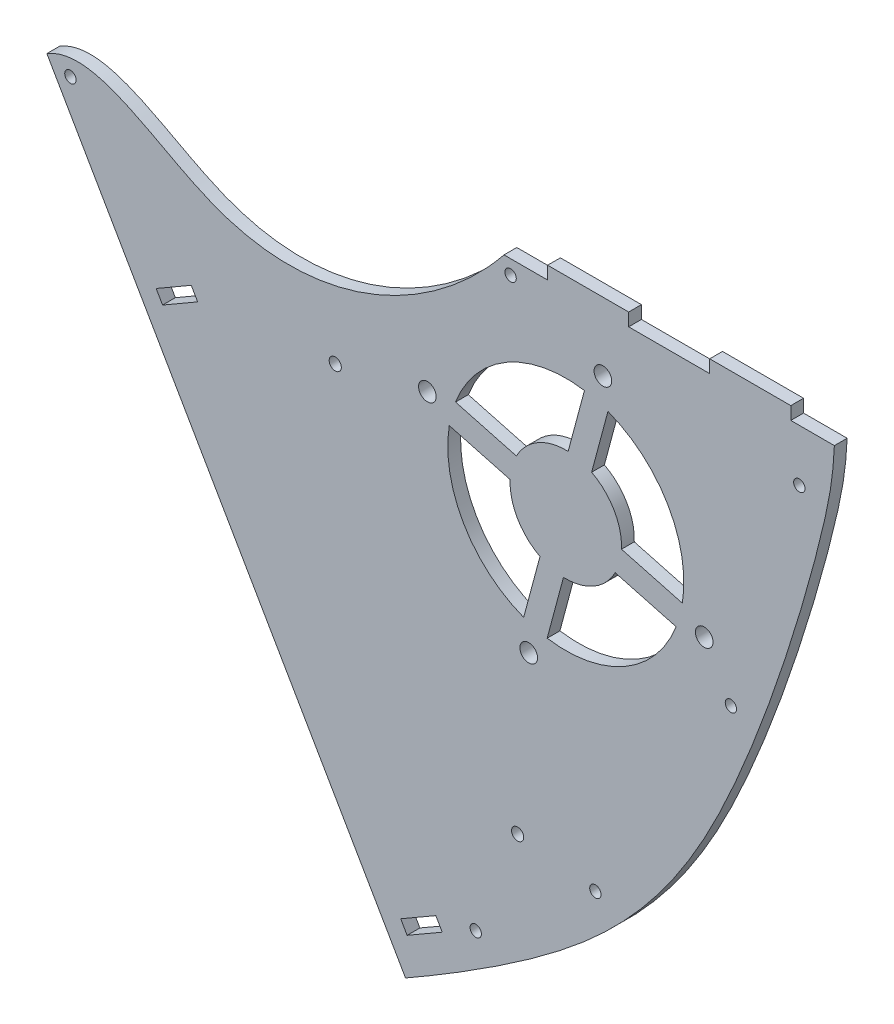
from build123d import *

# Parameters (mm, degrees)
SKETCH1_W           = 20
SKETCH1_H           = 3.17
BOSS_EXTRUDE1_DEPTH = 3.15
SKETCH3_R           = 1.5
CUT_EXTRUDE3_DEPTH  = 4
SKETCH4_R           = 1.4
CUT_EXTRUDE4_DEPTH  = 300.367282694
SKETCH5_R           = 1.4
CUT_EXTRUDE5_DEPTH  = 10
SKETCH8_R           = 1.4
CUT_EXTRUDE6_DEPTH  = 3.15
SKETCH10_R          = 2.175
CUT_EXTRUDE9_DEPTH  = 10


with BuildPart() as part:
    # Sketch1 → Boss-Extrude1 (new body)
    # profile 1 of 3: a face of its own
    with BuildSketch(Plane.XY):
        with BuildLine():
            Line((-241.698190941, -23.342278563), (-182.984296622, -125.037726634))
            Line((-182.984296622, -125.037726634), (-153.206187055, -176.614925358))
            add(Edge.make_bspline(
                [(-47.401899165, -9.957262145), (-47.829142386, -14.25185708), (-46.723988324, -19.969891501), (-68.682398123, -93.959649611), (-98.488851457, -144.156557444), (-142.971221813, -170.754120269), (-153.206187055, -176.614925358)],
                knots=[0.137311336, 0.137311336, 0.137311336, 0.137311336, 0.404180931, 0.63636099, 0.837197323, 0.978117302, 0.978117302, 0.978117302, 0.978117302], degree=3))
            Line((-47.401899165, -9.957262145), (-128.909491715, -9.957262145))
            add(Edge.make_bspline(
                [(-241.698190941, -23.342278563), (-229.917917727, -16.192032852), (-187.817846519, -53.973476211), (-145.539794723, -30.618927667), (-128.909491715, -9.957262145)],
                knots=[0, 0, 0, 0, 0.348890398, 1, 1, 1, 1], degree=3))
        make_face()
        Polygon((-206.071121951, -55.050172178), (-214.731375989, -60.050172178), (-213.146375989, -62.795472708), (-204.486121951, -57.795472708), align=None, mode=Mode.SUBTRACT)
        Polygon((-145.736121951, -159.553457653), (-154.396375989, -164.553457653), (-152.811375989, -167.298758183), (-144.151121951, -162.298758183), align=None, mode=Mode.SUBTRACT)
    # profile 2 of 3: a face of its own
    with BuildSketch(Plane.XY):
        with Locations((-108.15569544, -8.372262145)):
            Rectangle(SKETCH1_W, SKETCH1_H)
    # profile 3 of 3: a face of its own
    with BuildSketch(Plane.XY):
        with Locations((-68.15569544, -8.372262145)):
            Rectangle(SKETCH1_W, SKETCH1_H)
    extrude(amount=BOSS_EXTRUDE1_DEPTH)

    # Sketch3 → Cut-Extrude3 (cut)
    with BuildSketch(Plane.XY.offset(3.15)):
        with Locations((-170.547828083, -54.078322011)):
            Circle(SKETCH3_R)
        with Locations((-125.547828083, -132.020608351)):
            Circle(SKETCH3_R)
    extrude(amount=-CUT_EXTRUDE3_DEPTH, mode=Mode.SUBTRACT)

    # Sketch4 → Cut-Extrude4 (cut, through all)
    with BuildSketch(Plane(origin=(0, 0, 0), x_dir=(-1, 0, 0), z_dir=(0, 0, -1))):
        with Locations((235.892202029, -25.398546347)):
            Circle(SKETCH4_R)
    extrude(amount=-CUT_EXTRUDE4_DEPTH, mode=Mode.SUBTRACT)

    # Sketch5 → Cut-Extrude5 (cut)
    with BuildSketch(Plane(origin=(0, 0, 0), x_dir=(-1, 0, 0), z_dir=(0, 0, -1))):
        with Locations((127.284730109, -13.492653155)):
            Circle(SKETCH5_R)
    extrude(amount=-CUT_EXTRUDE5_DEPTH, mode=Mode.SUBTRACT)

    # Sketch8 → Cut-Extrude6 (cut)
    with BuildSketch(Plane(origin=(0, 0, 0), x_dir=(-1, 0, 0), z_dir=(0, 0, -1))):
        with Locations((56.049452266, -22.790015721)):
            Circle(SKETCH8_R)
        with Locations((72.929258412, -78.332275214)):
            Circle(SKETCH8_R)
        with Locations((106.365497467, -134.675290405)):
            Circle(SKETCH8_R)
        with Locations((135.879277113, -157.853014262)):
            Circle(SKETCH8_R)
    extrude(amount=-CUT_EXTRUDE6_DEPTH, mode=Mode.SUBTRACT)

    # Sketch10 → Cut-Extrude9 (cut)
    with BuildSketch(Plane(origin=(0, 0, 0), x_dir=(-1, 0, 0), z_dir=(0, 0, -1))):
        with BuildLine():
            ThreePointArc((86.455124846, -68.17754579), (99.09911767, -83.004749353), (118.261849034, -86.541166561))
            Line((118.261849034, -86.541166561), (114.236864862, -71.519721131))
            ThreePointArc((114.236864862, -71.519721131), (106.78661767, -69.68960877), (101.476570277, -64.152561617))
            Line((101.476570277, -64.152561617), (86.455124846, -68.17754579))
        make_face()
        with BuildLine():
            ThreePointArc((103.265831348, -30.575266644), (88.438627785, -43.219259467), (84.902210576, -62.381990832))
            Line((84.902210576, -62.381990832), (99.923656006, -58.35700666))
            ThreePointArc((99.923656006, -58.35700666), (101.753768368, -50.906759467), (107.29081552, -45.596712075))
            Line((107.29081552, -45.596712075), (103.265831348, -30.575266644))
        make_face()
        with BuildLine():
            Line((125.846665063, -51.410957318), (140.868110493, -47.385973145))
            ThreePointArc((140.868110493, -47.385973145), (128.22411767, -32.558769582), (109.061386305, -29.022352374))
            Line((109.061386305, -29.022352374), (113.086370478, -44.043797804))
            ThreePointArc((113.086370478, -44.043797804), (120.53661767, -45.873910165), (125.846665063, -51.410957318))
        make_face()
        with BuildLine():
            Line((120.03241982, -69.96680686), (124.057403992, -84.988252291))
            ThreePointArc((124.057403992, -84.988252291), (137.651645824, -74.296727653), (142.78661767, -57.781759467))
            ThreePointArc((142.78661767, -57.781759467), (142.695075581, -55.474391553), (142.421024764, -53.181528103))
            Line((142.421024764, -53.181528103), (127.399579333, -57.206512275))
            ThreePointArc((127.399579333, -57.206512275), (125.569466972, -64.656759467), (120.03241982, -69.96680686))
        make_face()
        with Locations((147.812252764, -48.631124373)):
            Circle(SKETCH10_R)
        with Locations((104.510982575, -23.631124373)):
            Circle(SKETCH10_R)
        with Locations((79.510982575, -66.932394562)):
            Circle(SKETCH10_R)
        with Locations((122.812252764, -91.932394562)):
            Circle(SKETCH10_R)
    extrude(amount=-CUT_EXTRUDE9_DEPTH, mode=Mode.SUBTRACT)


solid = part.part
